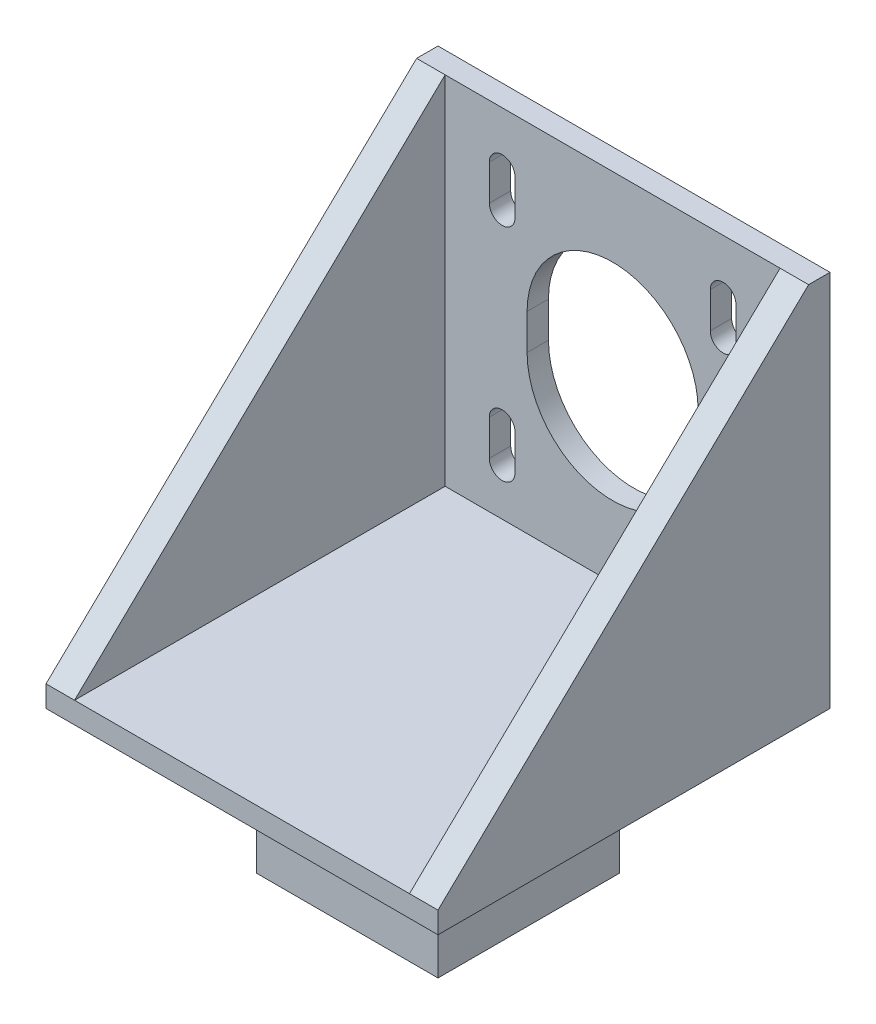
from build123d import *

# Parameters (mm, degrees)
SKETCH1_W           = 25.5
SKETCH1_H           = 25.5
SKETCH1_W_2         = 19.5
SKETCH1_H_2         = 19.5
BOSS_EXTRUDE1_DEPTH = 20
SKETCH2_W           = 55
SKETCH2_H           = 55
BOSS_EXTRUDE2_DEPTH = 3
SKETCH3_W           = 55
SKETCH3_H           = 3
BOSS_EXTRUDE3_DEPTH = 50
BOSS_EXTRUDE4_DEPTH = 4
CUT_EXTRUDE1_DEPTH  = 80.178595592


with BuildPart() as part:
    # Sketch1 → Boss-Extrude1 (new body)
    with BuildSketch(Plane(origin=(0, 0, 0), x_dir=(1, 0, 0), z_dir=(0, 1, 0))):
        Rectangle(SKETCH1_W, SKETCH1_H)
        Rectangle(SKETCH1_W_2, SKETCH1_H_2, mode=Mode.SUBTRACT)
    extrude(amount=-BOSS_EXTRUDE1_DEPTH)

    # Sketch2 → Boss-Extrude2 (add)
    with BuildSketch(Plane(origin=(0, 0, 0), x_dir=(1, 0, 0), z_dir=(0, 1, 0))):
        Rectangle(SKETCH2_W, SKETCH2_H)
    extrude(amount=BOSS_EXTRUDE2_DEPTH)

    # Sketch3 → Boss-Extrude3 (add)
    with BuildSketch(Plane(origin=(0, 3, 0), x_dir=(1, 0, 0), z_dir=(0, 1, 0))):
        with Locations((0, 26)):
            Rectangle(SKETCH3_W, SKETCH3_H)
    extrude(amount=BOSS_EXTRUDE3_DEPTH)

    # Sketch4 → Boss-Extrude4 (add)
    with BuildSketch(Plane.ZY.offset(27.5)):
        Polygon((-24.5, 3), (27.5, 3), (-24.5, 53), align=None)
    boss_extrude4 = extrude(amount=-BOSS_EXTRUDE4_DEPTH)

    # Mirror1: Boss-Extrude4 across plane
    add(boss_extrude4.mirror(Plane(origin=(0, 0, 0), x_dir=(0, 0, 1), z_dir=(1, 0, 0))))

    # Sketch5 → Cut-Extrude1 (cut, through all)
    with BuildSketch(Plane.XY.offset(-24.5)):
        with BuildLine():
            Line((-17.3, 9.5), (-17.3, 14.5))
            ThreePointArc((-17.3, 14.5), (-15.5, 16.3), (-13.7, 14.5))
            Line((-13.7, 14.5), (-13.7, 9.5))
            ThreePointArc((-13.7, 9.5), (-15.5, 7.7), (-17.3, 9.5))
        make_face()
        with BuildLine():
            Line((13.7, 9.5), (13.7, 14.5))
            ThreePointArc((13.7, 14.5), (15.5, 16.3), (17.3, 14.5))
            Line((17.3, 14.5), (17.3, 9.5))
            ThreePointArc((17.3, 9.5), (15.5, 7.7), (13.7, 9.5))
        make_face()
        with BuildLine():
            Line((13.7, 40.5), (13.7, 45.5))
            ThreePointArc((13.7, 45.5), (15.5, 47.3), (17.3, 45.5))
            Line((17.3, 45.5), (17.3, 40.5))
            ThreePointArc((17.3, 40.5), (15.5, 38.7), (13.7, 40.5))
        make_face()
        with BuildLine():
            Line((-17.3, 40.5), (-17.3, 45.5))
            ThreePointArc((-17.3, 45.5), (-15.5, 47.3), (-13.7, 45.5))
            Line((-13.7, 45.5), (-13.7, 40.5))
            ThreePointArc((-13.7, 40.5), (-15.5, 38.7), (-17.3, 40.5))
        make_face()
        with BuildLine():
            Line((-12, 25), (-12, 30))
            ThreePointArc((-12, 30), (0, 42), (12, 30))
            Line((12, 30), (12, 25))
            ThreePointArc((12, 25), (0, 13), (-12, 25))
        make_face()
    extrude(amount=-CUT_EXTRUDE1_DEPTH, mode=Mode.SUBTRACT)


solid = part.part
